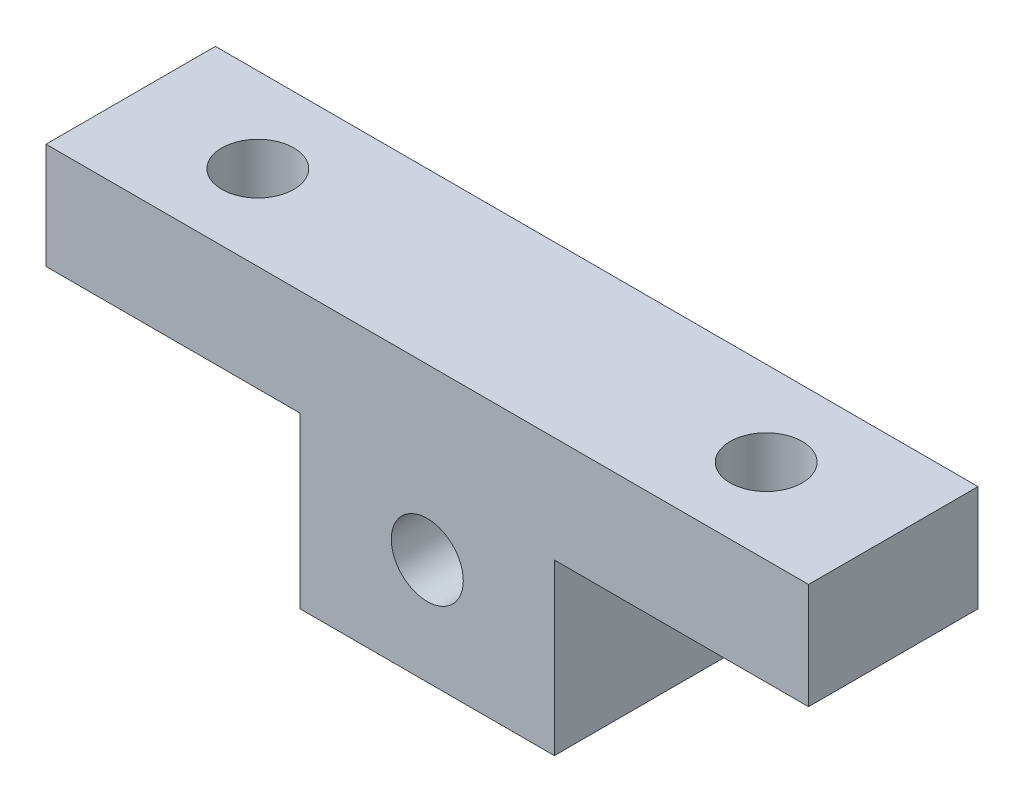
from build123d import *

# Parameters (mm, degrees)
BOSS_EXTRUDE1_DEPTH  = 8
M3_CLEARANCE_HOLE1_D = 3.4
M3_CLEARANCE_HOLE2_D = 3.4


with BuildPart() as part:
    # Sketch1 → Boss-Extrude1 (new body)
    with BuildSketch(Plane.XY):
        Polygon((0, 0), (0, 5), (36, 5), (36, 0), (24, 0), (24, -8), (12, -8), (12, 0), align=None)
    extrude(amount=BOSS_EXTRUDE1_DEPTH)

    # M3 Clearance Hole1 (through all)
    with Locations(Plane.XY.offset(8)):
        with Locations((18, -3)):
            Hole(M3_CLEARANCE_HOLE1_D / 2)

    # M3 Clearance Hole2 (through all)
    with Locations(Plane(origin=(0, 0, 0), x_dir=(-1, 0, 0), z_dir=(0, -1, 0))):
        with Locations((-6, -4), (-30, -4)):
            Hole(M3_CLEARANCE_HOLE2_D / 2)


solid = part.part
